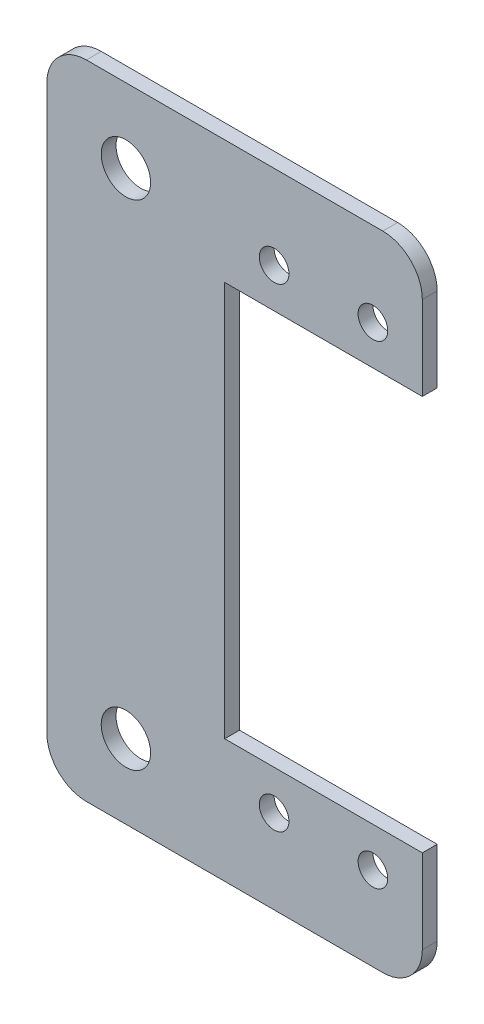
from build123d import *

# Parameters (mm, degrees)
ESQUISSE1_R        = 2.5
ESQUISSE1_R_2      = 1.5
BOSS_EXTRU_1_DEPTH = 1.5
CONG_1_R           = 4


with BuildPart() as part:
    # Esquisse1 → Boss.-Extru.1 (new body)
    with BuildSketch(Plane.XY):
        Polygon((38, -20), (38, -32.5), (0, -32.5), (0, 32.5), (38, 32.5), (38, 20), (18, 20), (18, -20), align=None)
        with Locations((8, 25)):
            Circle(ESQUISSE1_R, mode=Mode.SUBTRACT)
        with Locations((23, 24)):
            Circle(ESQUISSE1_R_2, mode=Mode.SUBTRACT)
        with Locations(Location((33, 24, 0), (0, 0, 180))):
            Circle(ESQUISSE1_R_2, mode=Mode.SUBTRACT)
        with Locations((33, -24)):
            Circle(ESQUISSE1_R_2, mode=Mode.SUBTRACT)
        with Locations(Location((23, -24, 0), (0, 0, 180))):
            Circle(ESQUISSE1_R_2, mode=Mode.SUBTRACT)
        with Locations(Location((8, -25, 0), (0, 0, 180))):
            Circle(ESQUISSE1_R, mode=Mode.SUBTRACT)
    extrude(amount=BOSS_EXTRU_1_DEPTH)

    # Congé1
    cong_1_edges = [part.edges().sort_by_distance(p)[0] for p in [
        (38, -32.5, 0.75),
        (0, -32.5, 0.75),
        (0, 32.5, 0.75),
        (38, 32.5, 0.75),
    ]]
    fillet(cong_1_edges, radius=CONG_1_R)


solid = part.part
